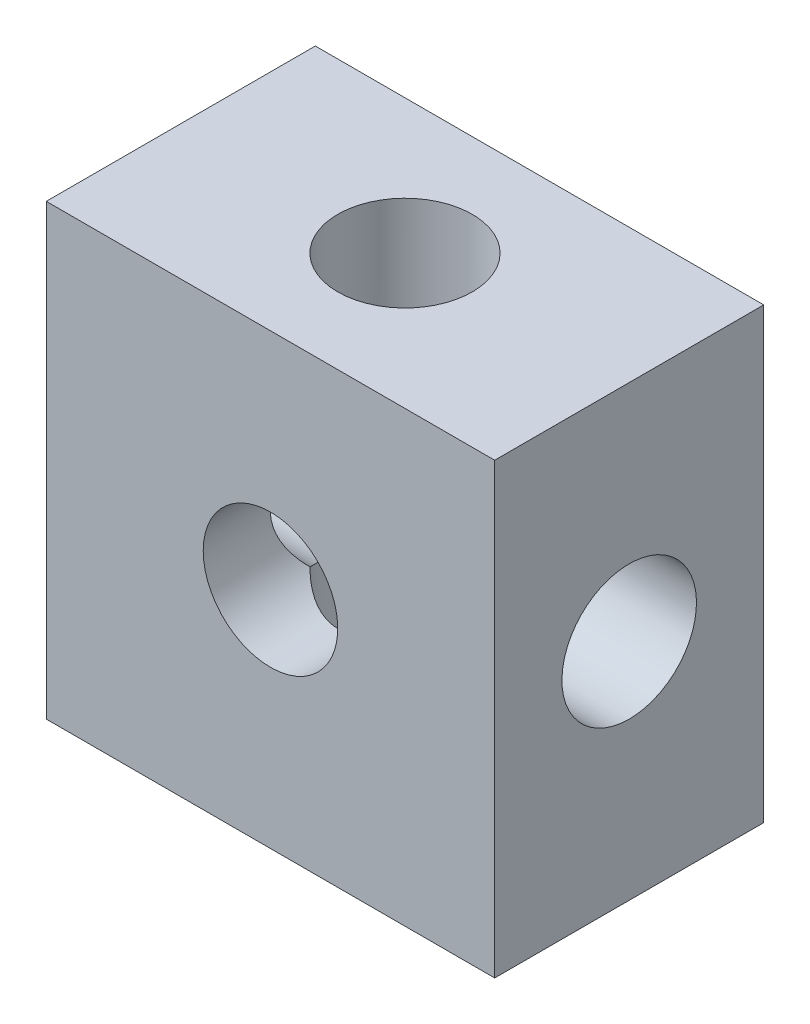
from build123d import *

# Parameters (mm, degrees)
SKETCH_1_W          = 10
SKETCH_1_H          = 10
EXTRUDE_1_DEPTH     = 3
SKETCH_2_R          = 1.5
CUT_EXTRUDE_1_DEPTH = 12.575836903
SKETCH_3_R          = 1.5
CUT_EXTRUDE_2_DEPTH = 12.575836903
SKETCH_4_R          = 1.5
CUT_EXTRUDE_3_DEPTH = 10.273618495


with BuildPart() as part:
    # 草图1 → 凸台-拉伸1 (new, symmetric)
    with BuildSketch(Plane.XY):
        Rectangle(SKETCH_1_W, SKETCH_1_H)
    extrude(amount=EXTRUDE_1_DEPTH, both=True)

    # 草图2 → 切除-拉伸1 (cut, through all)
    with BuildSketch(Plane(origin=(0, 5, 0), x_dir=(1, 0, 0), z_dir=(0, 1, 0))):
        with Locations(Location((0, 0, 0), (0, 0, 270))):
            Circle(SKETCH_2_R)
    extrude(amount=-CUT_EXTRUDE_1_DEPTH, mode=Mode.SUBTRACT)

    # 草图3 → 切除-拉伸2 (cut, through all)
    with BuildSketch(Plane.ZY.offset(5)):
        with Locations(Location((0, 0, 0), (0, 0, 270))):
            Circle(SKETCH_3_R)
    extrude(amount=-CUT_EXTRUDE_2_DEPTH, mode=Mode.SUBTRACT)

    # 草图4 → 切除-拉伸3 (cut, through all)
    with BuildSketch(Plane(origin=(0, 0, -3), x_dir=(-1, 0, 0), z_dir=(0, 0, -1))):
        Circle(SKETCH_4_R)
    extrude(amount=-CUT_EXTRUDE_3_DEPTH, mode=Mode.SUBTRACT)


solid = part.part
